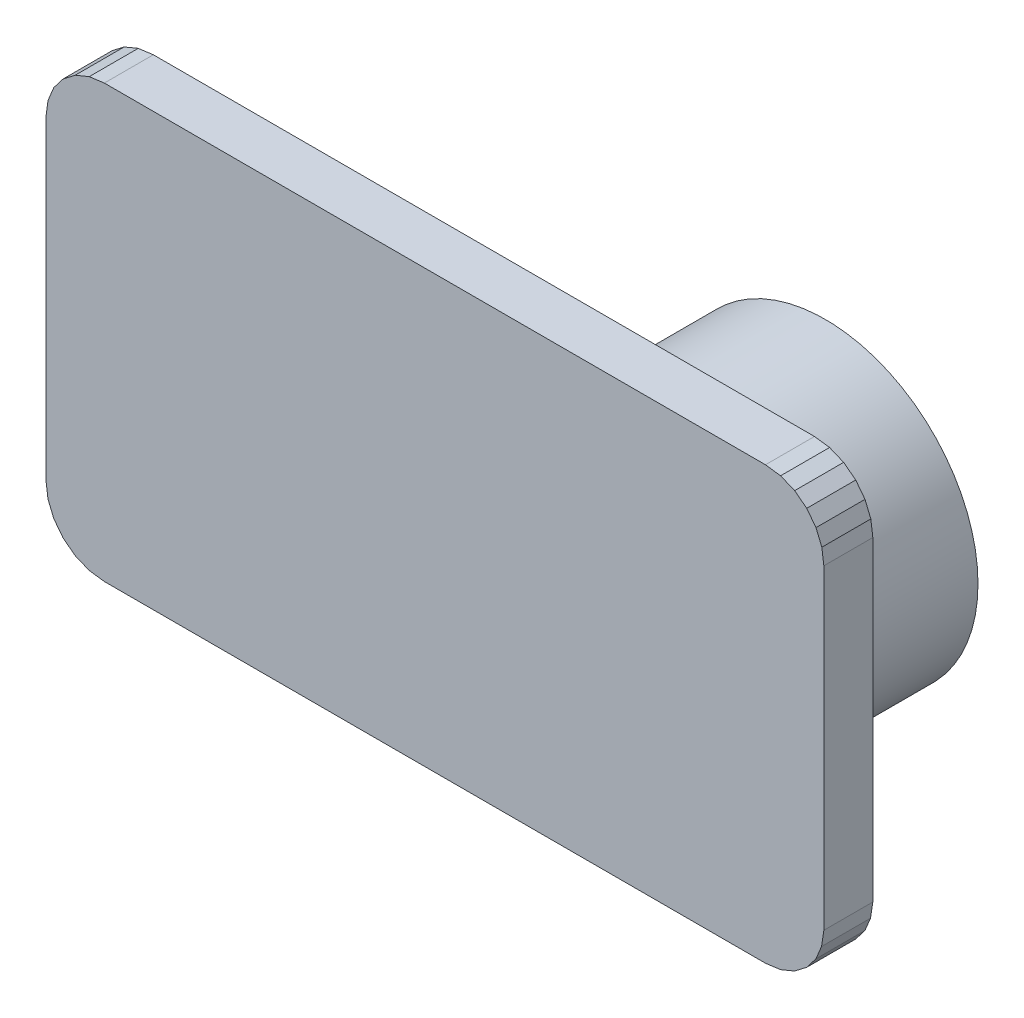
from build123d import *

# Parameters (mm, degrees)
BOSS_EXTRUDE1_DEPTH = 1.6
SKETCH1_R           = 4.985014332
BOSS_EXTRUDE2_DEPTH = 5.5


with BuildPart() as part:
    # Board_Outline → Boss-Extrude1 (new body)
    with BuildSketch(Plane.XY):
        Polygon((0, 12.192), (0, 1.905), (0.064911, 1.41195), (0.255222, 0.9525), (0.557962, 0.557962), (0.9525, 0.255222), (1.41195, 0.064911), (1.905, 0), (23.495, 0), (23.98805, 0.064911), (24.4475, 0.255222), (24.842038, 0.557962), (25.142046405, 0.948978179), (25.325809203, 1.389546655), (25.4, 1.884780797), (25.4, 1.905), (25.4, 12.192), (25.335089, 12.68505), (25.144778, 13.1445), (24.842038, 13.539038), (24.4475, 13.841778), (23.98805, 14.032089), (23.495, 14.097), (1.905, 14.097), (1.41195, 14.032089), (0.9525, 13.841778), (0.557962, 13.539038), (0.255222, 13.1445), (0.064911, 12.68505), align=None)
    extrude(amount=BOSS_EXTRUDE1_DEPTH)

    # Sketch1 → Boss-Extrude2 (add)
    with BuildSketch(Plane(origin=(0, 0, 0), x_dir=(-1, 0, 0), z_dir=(0, 0, -1))):
        with Locations(Location((-18.349836539, 7.101234384, 0), (0, 0, 180))):
            Circle(SKETCH1_R)
    extrude(amount=BOSS_EXTRUDE2_DEPTH)


solid = part.part
